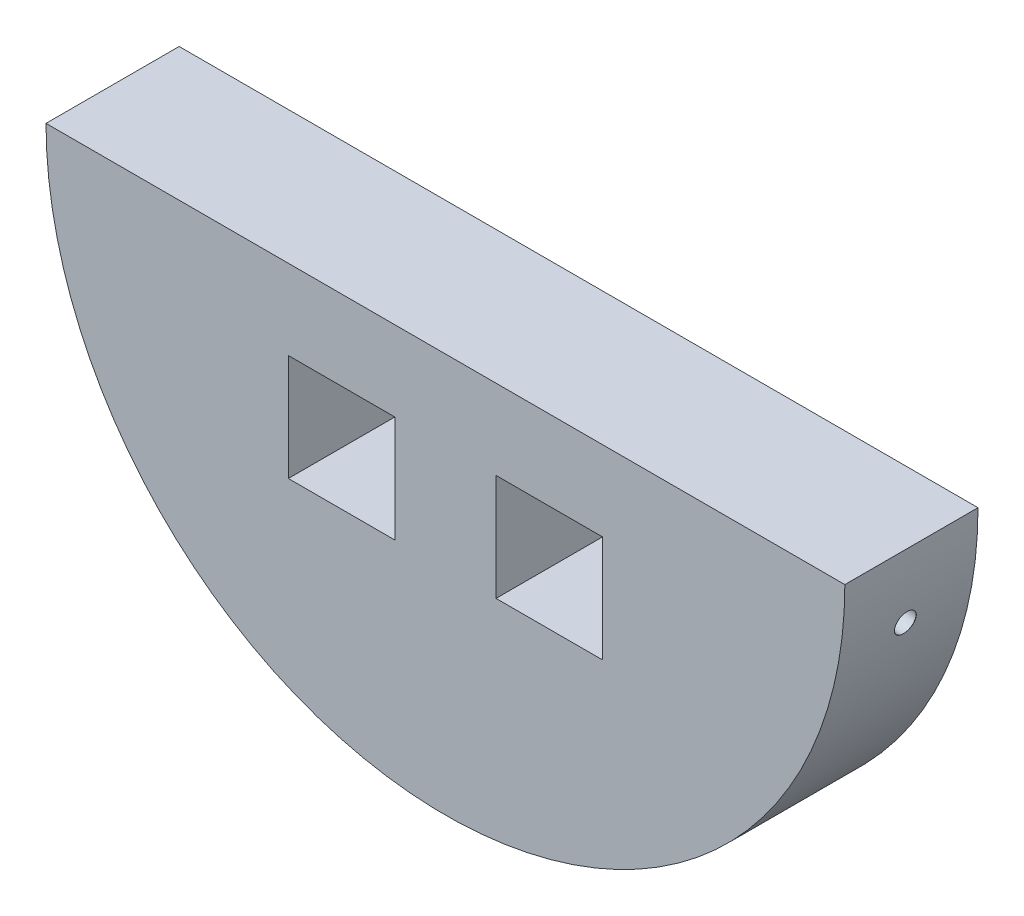
from build123d import *

# Parameters (mm, degrees)
SKETCH1_W           = 20
SKETCH1_H           = 20
BOSS_EXTRUDE1_DEPTH = 25
CIRPATTERN1_COUNT   = 5
CIRPATTERN1_ANGLE   = 160


with BuildPart() as part:
    # Sketch1 → Boss-Extrude1 (new body)
    with BuildSketch(Plane.XY):
        with BuildLine():
            Line((-150, 0), (0, 0))
            ThreePointArc((0, 0), (-75, -75), (-150, 0))
        make_face()
        with Locations((-55.5, -25)):
            Rectangle(SKETCH1_W, SKETCH1_H, mode=Mode.SUBTRACT)
        with Locations((-94.5, -25)):
            Rectangle(SKETCH1_W, SKETCH1_H, mode=Mode.SUBTRACT)
    extrude(amount=BOSS_EXTRUDE1_DEPTH)

    # Sketch4 → Ø4.0mm Dowel Hole2 (revolve, cut)
    with BuildSketch(Plane(origin=(-1.139418524, -13.023613325, 12.5), x_dir=(0.17364817766693047, 0.9848077530122081, 0), z_dir=(0, 0, 1))):
        Polygon((0, 0), (0, 17.201721238), (2, 16), (2, 0.025), (2.025, 0), align=None)
    f_4_0mm_dowel_hole2 = revolve(axis=Axis((5.114110708, -14.126279253, 12.5), (-0.9848077530122081, 0.17364817766693044, 0)), mode=Mode.SUBTRACT)

    # CirPattern1: Ø4.0mm Dowel Hole2 ×5 about axis
    cirpattern1_axis = Axis((-75, 0, 0), (0, 0, -1))
    for i in range(1, CIRPATTERN1_COUNT):
        add(f_4_0mm_dowel_hole2.rotate(cirpattern1_axis, i * CIRPATTERN1_ANGLE / (CIRPATTERN1_COUNT - 1)), mode=Mode.SUBTRACT)


solid = part.part
